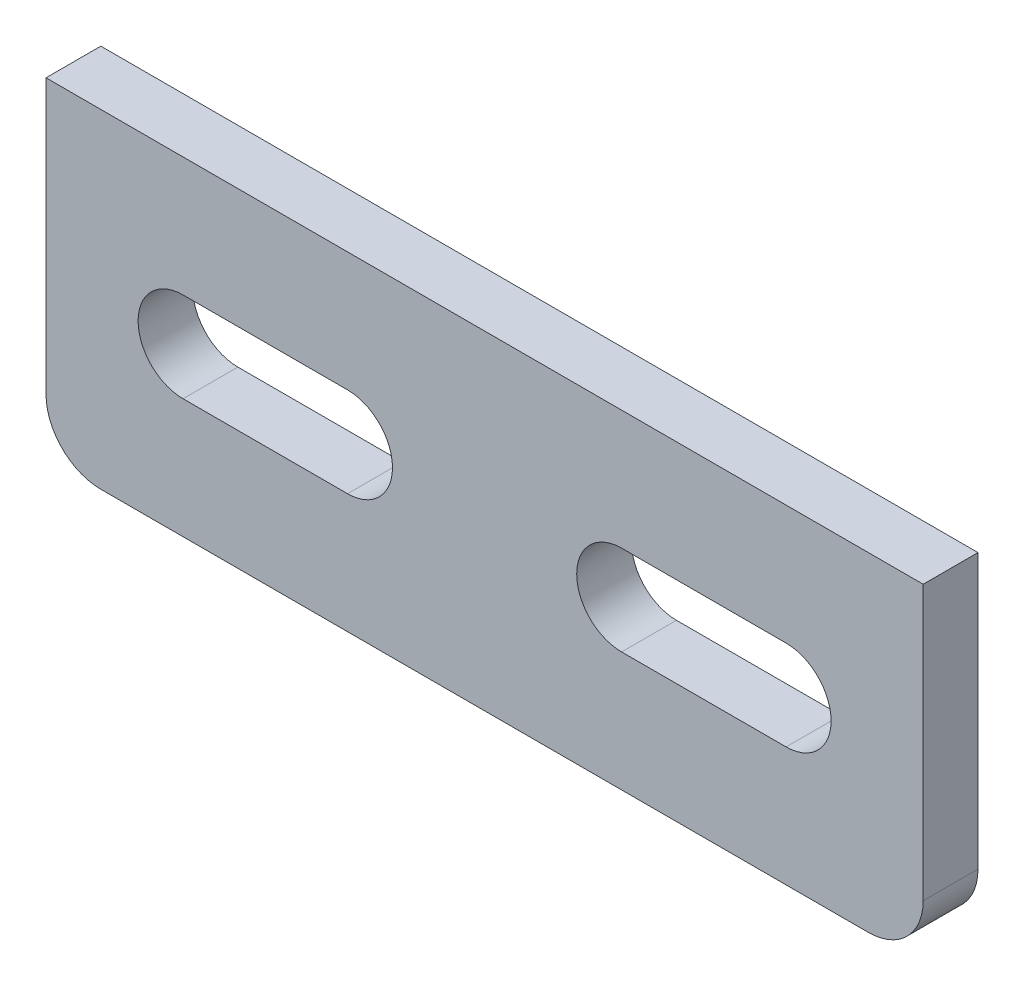
from build123d import *

# Parameters (mm, degrees)
IZIM1_W                     = 80
IZIM1_H                     = 30
Y_KSEKLIK_EKSTR_ZYON1_DEPTH = 5
RADYUS2_R                   = 5
KES_EKSTR_ZYON1_DEPTH       = 8


with BuildPart() as part:
    # Çizim1 → Yükseklik-Ekstrüzyon1 (new body)
    with BuildSketch(Plane.XY):
        Rectangle(IZIM1_W, IZIM1_H)
    extrude(amount=Y_KSEKLIK_EKSTR_ZYON1_DEPTH)

    # Radyus2
    radyus2_edges = [part.edges().sort_by_distance(p)[0] for p in [
        (40, -15, 2.5),
        (-40, -15, 2.5),
    ]]
    fillet(radyus2_edges, radius=RADYUS2_R)

    # Çizim2 → Kes-Ekstrüzyon1 (cut)
    with BuildSketch(Plane.XY.offset(5)):
        with BuildLine():
            Line((-27.5, 4.1), (-12.5, 4.1))
            ThreePointArc((-12.5, 4.1), (-8.4, 0), (-12.5, -4.1))
            Line((-12.5, -4.1), (-27.5, -4.1))
            ThreePointArc((-27.5, -4.1), (-31.6, 0), (-27.5, 4.1))
        make_face()
        with BuildLine():
            Line((12.5, 4.1), (27.5, 4.1))
            ThreePointArc((27.5, 4.1), (31.6, 0), (27.5, -4.1))
            Line((27.5, -4.1), (12.5, -4.1))
            ThreePointArc((12.5, -4.1), (8.4, 0), (12.5, 4.1))
        make_face()
    extrude(amount=-KES_EKSTR_ZYON1_DEPTH, mode=Mode.SUBTRACT)


solid = part.part
